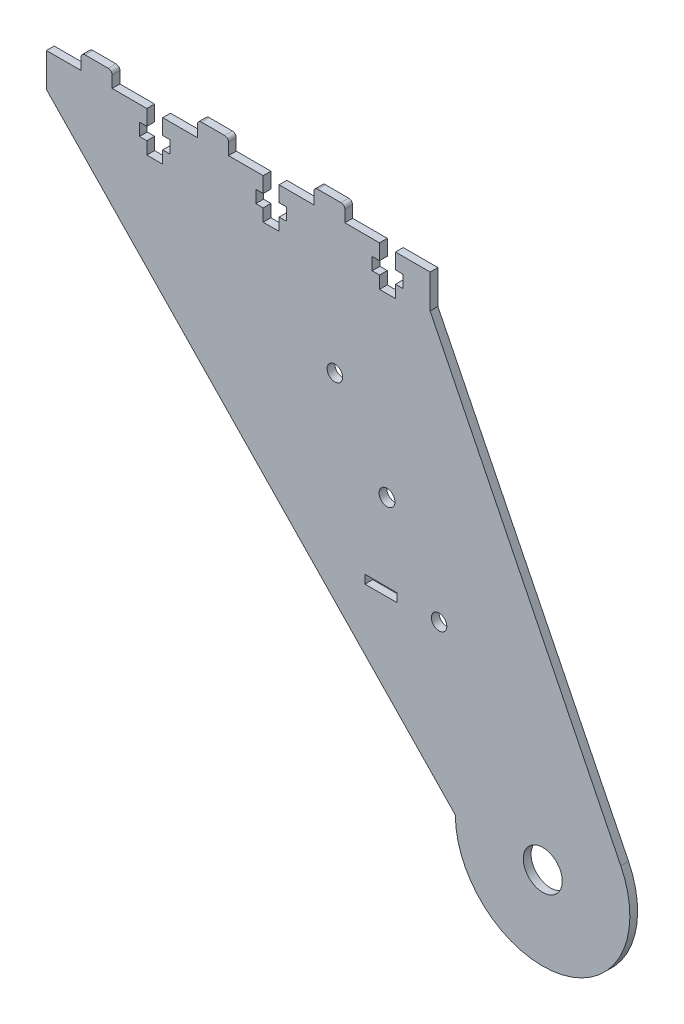
from build123d import *

# Parameters (mm, degrees)
SKETCH_1_R      = 2
SKETCH_1_R_2    = 5.02
SKETCH_1_R_3    = 2.05
SKETCH_1_W      = 8.2
SKETCH_1_H      = 2.2
EXTRUDE_1_DEPTH = 2
FILLET_1_R      = 1


with BuildPart() as part:
    # 草图1 → 凸台-拉伸1 (new body)
    with BuildSketch(Plane.XY):
        with BuildLine():
            Line((-38.25, 66.25), (-38.25, 62.25))
            Line((-38.25, 62.25), (-40.15, 62.25))
            Line((-40.15, 62.25), (-40.15, 59.05))
            Line((-40.15, 59.05), (-38.25, 59.05))
            Line((-38.25, 59.05), (-38.25, 55.85))
            Line((-38.25, 55.85), (-34.15, 55.85))
            Line((-34.15, 55.85), (-34.15, 59.05))
            Line((-34.15, 59.05), (-32.25, 59.05))
            Line((-32.25, 59.05), (-32.25, 62.25))
            Line((-32.25, 62.25), (-34.15, 62.25))
            Line((-34.15, 62.25), (-34.15, 66.25))
            Line((-34.15, 66.25), (-25.2, 66.25))
            Line((-25.2, 66.25), (-25.2, 70.25))
            Line((-25.2, 70.25), (-17.2, 70.25))
            Line((-17.2, 70.25), (-17.2, 66.25))
            Line((-17.2, 66.25), (-8.25, 66.25))
            Line((-8.25, 66.25), (-8.25, 62.25))
            Line((-8.25, 62.25), (-10.15, 62.25))
            Line((-10.15, 62.25), (-10.15, 59.05))
            Line((-10.15, 59.05), (-8.25, 59.05))
            Line((-8.25, 59.05), (-8.25, 55.85))
            Line((-8.25, 55.85), (-4.15, 55.85))
            Line((-4.15, 55.85), (-4.15, 59.05))
            Line((-4.15, 59.05), (-2.25, 59.05))
            Line((-2.25, 59.05), (-2.25, 62.25))
            Line((-2.25, 62.25), (-4.15, 62.25))
            Line((-4.15, 62.25), (-4.15, 66.25))
            Line((-4.15, 66.25), (4.8, 66.25))
            Line((4.8, 66.25), (4.8, 57.55))
            Line((4.8, 57.55), (53.96460577, -41.768082641))
            ThreePointArc((53.96460577, -41.768082641), (38.925737517, -73.658373169), (11.3, -51.75))
            Line((11.3, -51.75), (-94.15, 57.55))
            Line((-94.15, 57.55), (-94.15, 66.25))
            Line((-94.15, 66.25), (-85.2, 66.25))
            Line((-85.2, 66.25), (-85.2, 70.25))
            Line((-85.2, 70.25), (-77.2, 70.25))
            Line((-77.2, 70.25), (-77.2, 66.25))
            Line((-77.2, 66.25), (-68.25, 66.25))
            Line((-68.25, 66.25), (-68.25, 62.25))
            Line((-68.25, 62.25), (-70.15, 62.25))
            Line((-70.15, 62.25), (-70.15, 59.05))
            Line((-70.15, 59.05), (-68.25, 59.05))
            Line((-68.25, 59.05), (-68.25, 55.85))
            Line((-68.25, 55.85), (-64.15, 55.85))
            Line((-64.15, 55.85), (-64.15, 59.05))
            Line((-64.15, 59.05), (-62.25, 59.05))
            Line((-62.25, 59.05), (-62.25, 62.25))
            Line((-62.25, 62.25), (-64.15, 62.25))
            Line((-64.15, 62.25), (-64.15, 66.25))
            Line((-64.15, 66.25), (-55.2, 66.25))
            Line((-55.2, 66.25), (-55.2, 70.25))
            Line((-55.2, 70.25), (-47.2, 70.25))
            Line((-47.2, 70.25), (-47.2, 66.25))
            Line((-47.2, 66.25), (-38.25, 66.25))
        make_face()
        with Locations((-19.762745434, 31.422010331)):
            Circle(SKETCH_1_R, mode=Mode.SUBTRACT)
        with Locations((7.098407643, -10.75)):
            Circle(SKETCH_1_R, mode=Mode.SUBTRACT)
        with Locations((33.85, -52.75)):
            Circle(SKETCH_1_R_2, mode=Mode.SUBTRACT)
        with Locations((-6.332168895, 10.336005166)):
            Circle(SKETCH_1_R_3, mode=Mode.SUBTRACT)
        with Locations((-7.901592357, -10.75)):
            Rectangle(SKETCH_1_W, SKETCH_1_H, mode=Mode.SUBTRACT)
    extrude(amount=EXTRUDE_1_DEPTH)

    # 圆角1
    fillet_1_edges = [part.edges().sort_by_distance(p)[0] for p in [
        (-25.2, 70.25, 1),
        (-17.2, 70.25, 1),
        (-85.2, 70.25, 1),
        (-77.2, 70.25, 1),
        (-55.2, 70.25, 1),
        (-47.2, 70.25, 1),
    ]]
    fillet(fillet_1_edges, radius=FILLET_1_R)


solid = part.part
